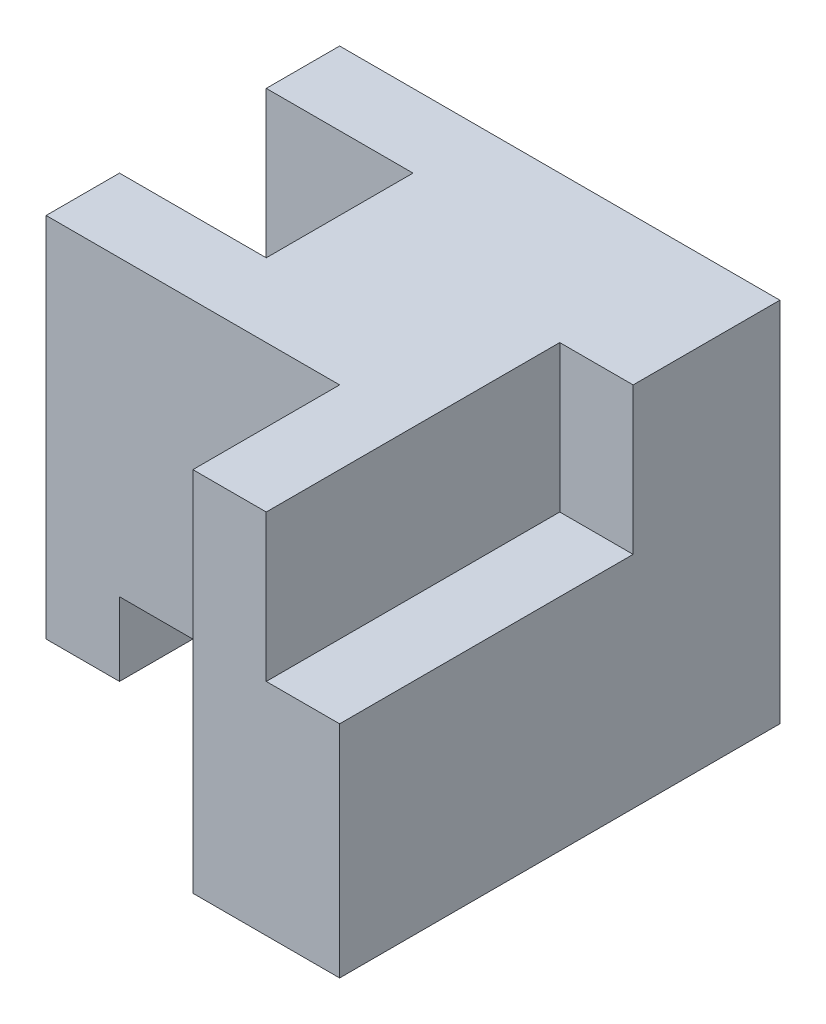
from build123d import *

# Parameters (mm, degrees)
BOSS_EXTRUDE1_DEPTH      = 120
BOSS_EXTRUDE2_DEPTH      = 120
SKETCH3_W                = 80
SKETCH3_H                = 80
BOSS_EXTRUDE3_DEPTH      = 40
BOSS_EXTRUDE4_DEPTH      = 40
BOSS_EXTRUDE5_DEPTH      = 120
SPLIT4_SURFACE_1_1_BACK  = 394.954
SPLIT4_SURFACE_1_1_DEPTH = 789.908
SPLIT4_SURFACE_1_2_BACK  = 394.954
SPLIT4_SURFACE_1_2_DEPTH = 789.908
SPLIT4_SURFACE_2_3_BACK  = 394.954
SPLIT4_SURFACE_2_3_DEPTH = 789.908
SPLIT4_SURFACE_2_4_BACK  = 394.954
SPLIT4_SURFACE_2_4_DEPTH = 789.908
CHAMFER4_SIZE            = 80


with BuildPart() as part:
    # Sketch1 → Boss-Extrude1 (new body)
    with BuildSketch(Plane.XY):
        Polygon((120, -100), (120, 20), (80, 20), (80, 100), (40, 100), (40, -60), (40, -100), align=None)
    extrude(amount=BOSS_EXTRUDE1_DEPTH)

    # Sketch1<3> → Boss-Extrude2 (add)
    with BuildSketch(Plane.XY):
        Polygon((120, -100), (120, 20), (80, 20), (80, 100), (40, 100), (40, -60), (40, -100), align=None)
    extrude(amount=-BOSS_EXTRUDE2_DEPTH)

    # Sketch3 → Boss-Extrude3 (add)
    with BuildSketch(Plane(origin=(80, 0, 0), x_dir=(0, 0, -1), z_dir=(1, 0, 0))):
        with Locations((80, 60)):
            Rectangle(SKETCH3_W, SKETCH3_H)
    extrude(amount=BOSS_EXTRUDE3_DEPTH)

    # Sketch1<4> → Boss-Extrude4 (add)
    with BuildSketch(Plane.XY):
        Polygon((40, -60), (40, 100), (-120, 100), (-120, -100), (-80, -100), (-80, -60), align=None)
    extrude(amount=BOSS_EXTRUDE4_DEPTH)

    # Sketch1<5> → Boss-Extrude5 (add)
    with BuildSketch(Plane.XY):
        Polygon((40, -60), (40, 100), (-120, 100), (-120, -100), (-80, -100), (-80, -60), align=None)
    extrude(amount=-BOSS_EXTRUDE5_DEPTH)


with BuildPart() as body_2:
    # Split4: the piece behind the surface
    add(part.part)
    # Split4 surface 1: a surface, the sketch's curves swept straight by 789.908 mm
    with BuildLine(Plane(origin=(0, 100, 0), x_dir=(1, 0, 0), z_dir=(0, 1, 0)).offset(-SPLIT4_SURFACE_1_1_BACK), mode=Mode.PRIVATE) as split4_surface_1_1_path:
        Line((-120, 0), (120, 0))
    split4_surface_1_1 = Shell.extrude(split4_surface_1_1_path.wire(), (0 * SPLIT4_SURFACE_1_1_DEPTH, 1 * SPLIT4_SURFACE_1_1_DEPTH, 0 * SPLIT4_SURFACE_1_1_DEPTH))
    split(bisect_by=split4_surface_1_1, keep=Keep.BOTTOM)


with BuildPart() as part_1:
    add(part.part)

    # Split4: split by a surface, the side it looks to stays
    # Split4 surface 1: a surface, the sketch's curves swept straight by 789.908 mm
    with BuildLine(Plane(origin=(0, 100, 0), x_dir=(1, 0, 0), z_dir=(0, 1, 0)).offset(-SPLIT4_SURFACE_1_2_BACK), mode=Mode.PRIVATE) as split4_surface_1_2_path:
        Line((-120, 0), (120, 0))
    split4_surface_1_2 = Shell.extrude(split4_surface_1_2_path.wire(), (0 * SPLIT4_SURFACE_1_2_DEPTH, 1 * SPLIT4_SURFACE_1_2_DEPTH, 0 * SPLIT4_SURFACE_1_2_DEPTH))
    split(bisect_by=split4_surface_1_2, keep=Keep.TOP)


with BuildPart() as body_3:
    # Split4 2: the piece behind the surface
    add(part_1.part)
    # Split4 surface 2: a surface, the sketch's curves swept straight by 789.908 mm
    with BuildLine(Plane(origin=(0, 100, 0), x_dir=(1, 0, 0), z_dir=(0, 1, 0)).offset(-SPLIT4_SURFACE_2_3_BACK), mode=Mode.PRIVATE) as split4_surface_2_3_path:
        Line((-120, 80), (120, 80))
    split4_surface_2_3 = Shell.extrude(split4_surface_2_3_path.wire(), (0 * SPLIT4_SURFACE_2_3_DEPTH, 1 * SPLIT4_SURFACE_2_3_DEPTH, 0 * SPLIT4_SURFACE_2_3_DEPTH))
    split(bisect_by=split4_surface_2_3, keep=Keep.BOTTOM)

    # Chamfer4
    chamfer4_edges = [body_3.edges().sort_by_distance(p)[0] for p in [
        (-120, 100, -40),
    ]]
    chamfer(chamfer4_edges, length=CHAMFER4_SIZE)


with BuildPart() as part_2:
    add(part_1.part)

    # Split4 2: split by a surface, the side it looks to stays
    # Split4 surface 2: a surface, the sketch's curves swept straight by 789.908 mm
    with BuildLine(Plane(origin=(0, 100, 0), x_dir=(1, 0, 0), z_dir=(0, 1, 0)).offset(-SPLIT4_SURFACE_2_4_BACK), mode=Mode.PRIVATE) as split4_surface_2_4_path:
        Line((-120, 80), (120, 80))
    split4_surface_2_4 = Shell.extrude(split4_surface_2_4_path.wire(), (0 * SPLIT4_SURFACE_2_4_DEPTH, 1 * SPLIT4_SURFACE_2_4_DEPTH, 0 * SPLIT4_SURFACE_2_4_DEPTH))
    split(bisect_by=split4_surface_2_4, keep=Keep.TOP)


with BuildPart() as body_3_1:
    add(body_3.part)

    # Combine2: union part, body 2
    add(part_2.part)
    add(body_2.part)


solid = body_3_1.part
